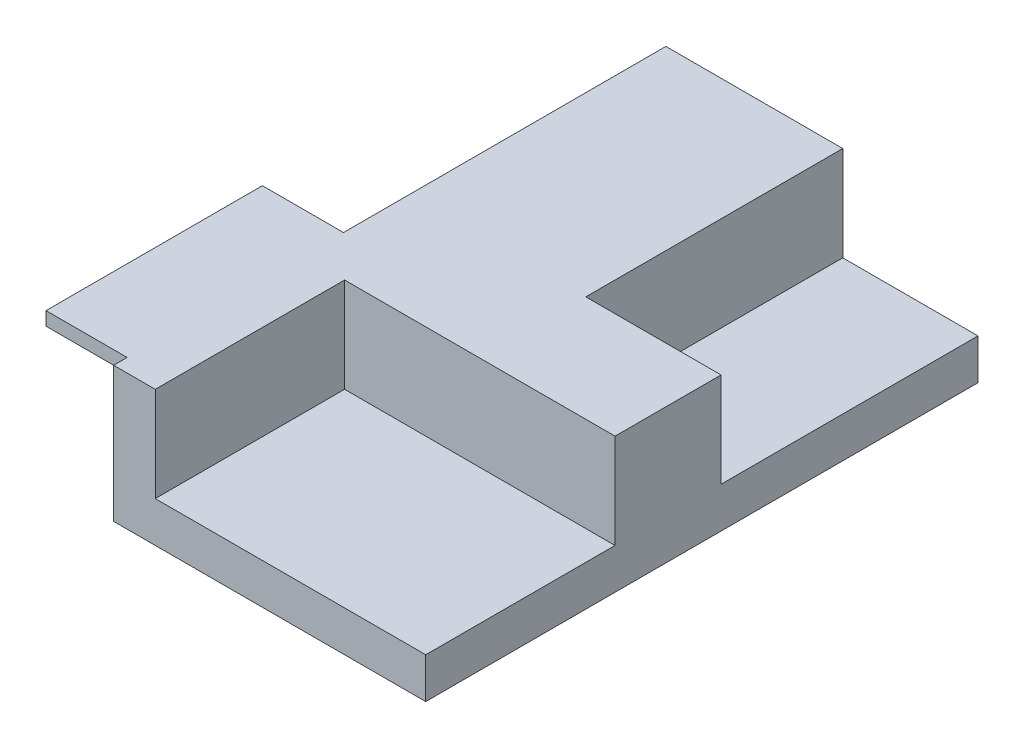
from build123d import *

# Parameters (mm, degrees)
MAINBODY_DWG_W  = 23.08
MAINBODY_DWG_H  = 40.84
MAIN_BODY_DEPTH = 10
PINS_DWG_W      = 16
PINS_DWG_H      = 1
PINS_DEPTH      = 6
RELIEF_DWG_W    = 10.001117723
RELIEF_DWG_H    = 19
RELIEF_DWG_W_2  = 20
RELIEF_DWG_H_2  = 14
RELIEF_DEPTH    = 7


with BuildPart() as part:
    # MAINBODY_DWG → MAIN_BODY (new body)
    with BuildSketch(Plane(origin=(0, 0, 0), x_dir=(1, 0, 0), z_dir=(0, 1, 0))):
        Rectangle(MAINBODY_DWG_W, MAINBODY_DWG_H)
    extrude(amount=MAIN_BODY_DEPTH)

    # PINS_DWG → PINS (add)
    with BuildSketch(Plane.ZY.offset(11.54)):
        with Locations((11.42, 9.5)):
            Rectangle(PINS_DWG_W, PINS_DWG_H)
    extrude(amount=PINS_DEPTH)

    # RELIEF_DWG → RELIEF (cut)
    with BuildSketch(Plane(origin=(0, 10, 0), x_dir=(1, 0, 0), z_dir=(0, 1, 0))):
        with Locations((6.539441139, 10.92)):
            Rectangle(RELIEF_DWG_W, RELIEF_DWG_H)
        with Locations((1.54, -13.42)):
            Rectangle(RELIEF_DWG_W_2, RELIEF_DWG_H_2)
    extrude(amount=-RELIEF_DEPTH, mode=Mode.SUBTRACT)


solid = part.part
